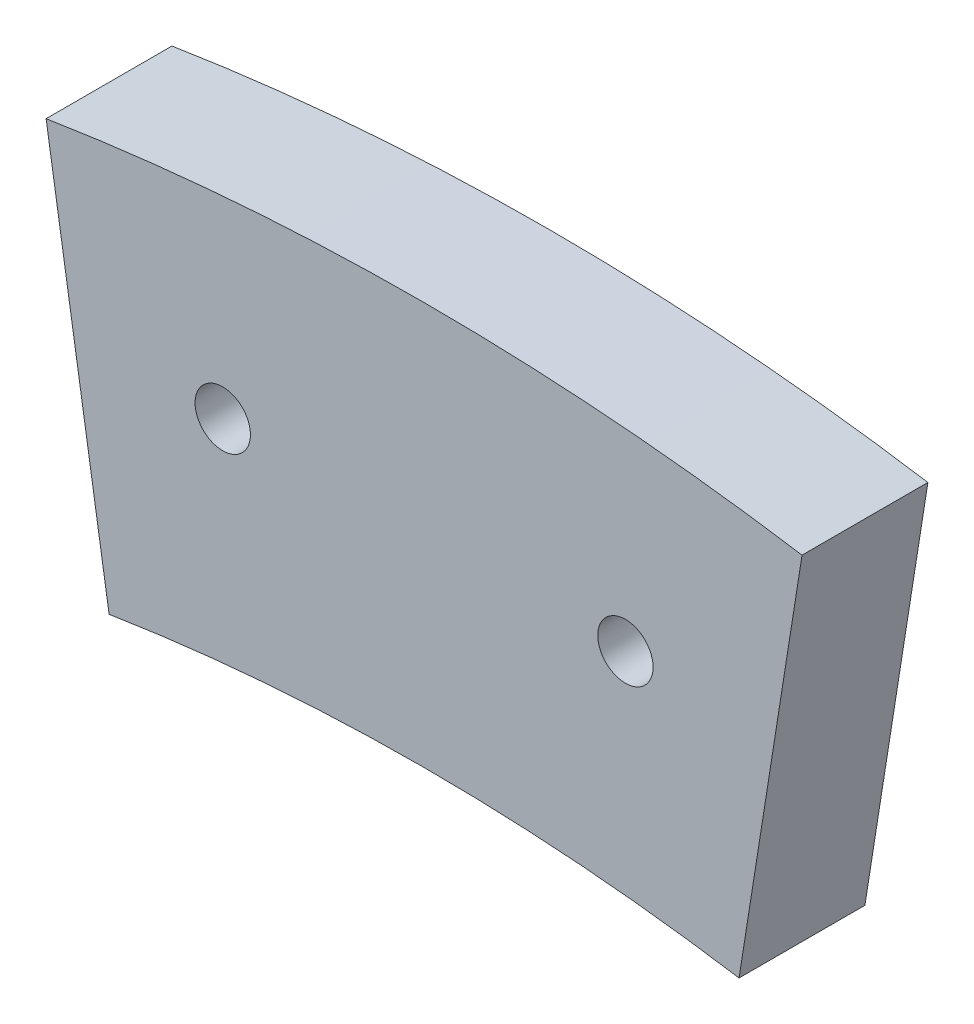
from build123d import *

# Parameters (mm, degrees)
SKETCH1_R           = 1.1
BOSS_EXTRUDE1_DEPTH = 5


with BuildPart() as part:
    # Sketch1 → Boss-Extrude1 (new body)
    with BuildSketch(Plane.XY):
        with BuildLine():
            Line((-13.453363993, 84.941197291), (-12.514757203, 79.015067248))
            ThreePointArc((-12.514757203, 79.015067248), (0, 80), (12.514757203, 79.015067248))
            Line((12.514757203, 79.015067248), (13.453363993, 84.941197291))
            Line((13.453363993, 84.941197291), (14.079101854, 88.891950654))
            Line((14.079101854, 88.891950654), (15.017708644, 94.818080697))
            ThreePointArc((15.017708644, 94.818080697), (0, 96), (-15.017708644, 94.818080697))
            Line((-15.017708644, 94.818080697), (-14.079101854, 88.891950654))
            Line((-14.079101854, 88.891950654), (-13.453363993, 84.941197291))
        make_face()
        with Locations((-8, 88)):
            Circle(SKETCH1_R, mode=Mode.SUBTRACT)
        with Locations((8, 88)):
            Circle(SKETCH1_R, mode=Mode.SUBTRACT)
    extrude(amount=BOSS_EXTRUDE1_DEPTH)


solid = part.part
